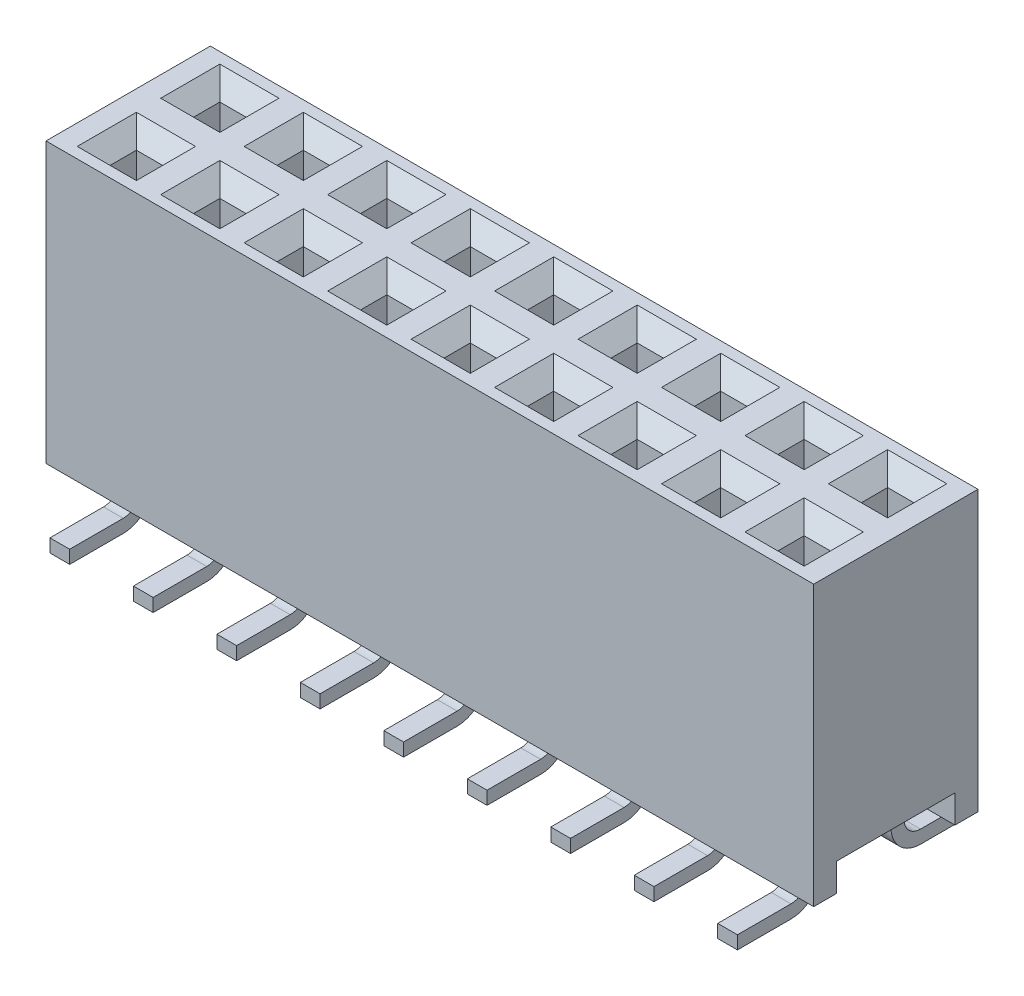
from build123d import *

# Parameters (mm, degrees)
EXTRUDE_1_DEPTH                    = 11.68
SKETCH_2_W                         = 0.8
SKETCH_2_H                         = 0.8
CUT_EXTRUDE_1_DEPTH                = 15.660231922
CHAMFER_1_SIZE                     = 0.5
PATTERN_LINEAR_1_COUNT             = 9
PATTERN_LINEAR_1_PITCH             = 2.54
PATTERN_LINEAR_1_COUNT_DIR2        = 2
PATTERN_LINEAR_1_PITCH_DIR2        = 2.54
CHAMFER_1_OF_PATTERN_LINEAR_1_SIZE = 0.5
EXTRUDE_2_DEPTH                    = 0.3
PATTERN_LINEAR_2_COUNT             = 5
PATTERN_LINEAR_2_PITCH             = 2.54
PATTERN_LINEAR_3_COUNT             = 5
PATTERN_LINEAR_3_PITCH             = 2.54


with BuildPart() as part:
    # Эскиз1 → Бобышка-Вытянуть1 (new, symmetric)
    with BuildSketch(Plane(origin=(0, 0, 0), x_dir=(0, 0, -1), z_dir=(1, 0, 0))):
        Polygon((-2.5, 1.2), (-2.5, 9.7), (2.5, 9.7), (2.5, 1.2), (1.8, 1.2), (1.8, 2.05), (-1.8, 2.05), (-1.8, 1.2), align=None)
    extrude(amount=EXTRUDE_1_DEPTH, both=True)

    # Эскиз2 → Вырез-Вытянуть1 (cut, through all)
    with BuildSketch(Plane(origin=(0, 9.7, 0), x_dir=(1, 0, 0), z_dir=(0, 1, 0))):
        with Locations((10.16, -1.27)):
            Rectangle(SKETCH_2_W, SKETCH_2_H)
    cut_extrude_1 = extrude(amount=-CUT_EXTRUDE_1_DEPTH, mode=Mode.SUBTRACT)

    # Фаска1
    chamfer_1_edges = [part.edges().sort_by_distance(p)[0] for p in [
        (10.56, 9.7, 1.27),
        (10.16, 9.7, 0.87),
        (9.76, 9.7, 1.27),
        (10.16, 9.7, 1.67),
    ]]
    chamfer(chamfer_1_edges, length=CHAMFER_1_SIZE)

    # Линейный массив1: Cut-Extrude 1 9 × 2
    with Locations(*[(-i * PATTERN_LINEAR_1_PITCH, 0, -j * PATTERN_LINEAR_1_PITCH_DIR2) for i in range(PATTERN_LINEAR_1_COUNT) for j in range(PATTERN_LINEAR_1_COUNT_DIR2) if (i, j) != (0, 0)]):
        add(cut_extrude_1, mode=Mode.SUBTRACT)

    # Фаска1 of Линейный массив1
    chamfer_1_of_pattern_linear_1_edges = [part.edges().sort_by_distance(p)[0] for p in [
        (10.56, 9.7, -1.27),
        (10.16, 9.7, -1.67),
        (9.76, 9.7, -1.27),
        (10.16, 9.7, -0.87),
        (8.02, 9.7, 1.27),
        (7.62, 9.7, 0.87),
        (7.22, 9.7, 1.27),
        (7.62, 9.7, 1.67),
        (8.02, 9.7, -1.27),
        (7.62, 9.7, -1.67),
        (7.22, 9.7, -1.27),
        (7.62, 9.7, -0.87),
        (5.48, 9.7, 1.27),
        (5.08, 9.7, 0.87),
        (4.68, 9.7, 1.27),
        (5.08, 9.7, 1.67),
        (5.48, 9.7, -1.27),
        (5.08, 9.7, -1.67),
        (4.68, 9.7, -1.27),
        (5.08, 9.7, -0.87),
        (2.94, 9.7, 1.27),
        (2.54, 9.7, 0.87),
        (2.14, 9.7, 1.27),
        (2.54, 9.7, 1.67),
        (2.94, 9.7, -1.27),
        (2.54, 9.7, -1.67),
        (2.14, 9.7, -1.27),
        (2.54, 9.7, -0.87),
        (0.4, 9.7, 1.27),
        (0, 9.7, 0.87),
        (-0.4, 9.7, 1.27),
        (0, 9.7, 1.67),
        (0.4, 9.7, -1.27),
        (0, 9.7, -1.67),
        (-0.4, 9.7, -1.27),
        (0, 9.7, -0.87),
        (-2.14, 9.7, 1.27),
        (-2.54, 9.7, 0.87),
        (-2.94, 9.7, 1.27),
        (-2.54, 9.7, 1.67),
        (-2.14, 9.7, -1.27),
        (-2.54, 9.7, -1.67),
        (-2.94, 9.7, -1.27),
        (-2.54, 9.7, -0.87),
        (-4.68, 9.7, 1.27),
        (-5.08, 9.7, 0.87),
        (-5.48, 9.7, 1.27),
        (-5.08, 9.7, 1.67),
        (-4.68, 9.7, -1.27),
        (-5.08, 9.7, -1.67),
        (-5.48, 9.7, -1.27),
        (-5.08, 9.7, -0.87),
        (-7.22, 9.7, 1.27),
        (-7.62, 9.7, 0.87),
        (-8.02, 9.7, 1.27),
        (-7.62, 9.7, 1.67),
        (-7.22, 9.7, -1.27),
        (-7.62, 9.7, -1.67),
        (-8.02, 9.7, -1.27),
        (-7.62, 9.7, -0.87),
        (-9.76, 9.7, 1.27),
        (-10.16, 9.7, 0.87),
        (-10.56, 9.7, 1.27),
        (-10.16, 9.7, 1.67),
        (-9.76, 9.7, -1.27),
        (-10.16, 9.7, -1.67),
        (-10.56, 9.7, -1.27),
        (-10.16, 9.7, -0.87),
    ]]
    chamfer(chamfer_1_of_pattern_linear_1_edges, length=CHAMFER_1_OF_PATTERN_LINEAR_1_SIZE)


with BuildPart() as body_2:
    # Эскиз3 → Бобышка-Вытянуть2 (new, symmetric)
    with BuildSketch(Plane(origin=(0, 0, 0), x_dir=(0, 0, -1), z_dir=(1, 0, 0))):
        with BuildLine():
            Line((-1.07, 0.9), (-1.07, 2.05))
            Line((-1.07, 2.05), (-1.47, 2.05))
            Line((-1.47, 2.05), (-1.47, 0.9))
            ThreePointArc((-1.47, 0.9), (-1.616446609, 0.546446609), (-1.97, 0.4))
            Line((-1.97, 0.4), (-3.6, 0.4))
            Line((-3.6, 0.4), (-3.6, 0))
            Line((-3.6, 0), (-1.97, 0))
            ThreePointArc((-1.97, 0), (-1.333603897, 0.263603897), (-1.07, 0.9))
        make_face()
    extrude(amount=EXTRUDE_2_DEPTH, both=True)


with BuildPart() as pattern_linear_2_1:
    # Линейный массив2: pattern copy
    add(body_2.part.moved(Location(Vector(1, 0, 0) * (1 * PATTERN_LINEAR_2_PITCH))))


with BuildPart() as pattern_linear_2_2:
    # Линейный массив2: pattern copy
    add(body_2.part.moved(Location(Vector(1, 0, 0) * (2 * PATTERN_LINEAR_2_PITCH))))


with BuildPart() as pattern_linear_2_3:
    # Линейный массив2: pattern copy
    add(body_2.part.moved(Location(Vector(1, 0, 0) * (3 * PATTERN_LINEAR_2_PITCH))))


with BuildPart() as pattern_linear_2_4:
    # Линейный массив2: pattern copy
    add(body_2.part.moved(Location(Vector(1, 0, 0) * (4 * PATTERN_LINEAR_2_PITCH))))


with BuildPart() as pattern_linear_3_1:
    # Линейный массив3: pattern copy
    add(body_2.part.moved(Location(Vector(-1, 0, 0) * (1 * PATTERN_LINEAR_3_PITCH))))


with BuildPart() as pattern_linear_3_2:
    # Линейный массив3: pattern copy
    add(body_2.part.moved(Location(Vector(-1, 0, 0) * (2 * PATTERN_LINEAR_3_PITCH))))


with BuildPart() as pattern_linear_3_3:
    # Линейный массив3: pattern copy
    add(body_2.part.moved(Location(Vector(-1, 0, 0) * (3 * PATTERN_LINEAR_3_PITCH))))


with BuildPart() as pattern_linear_3_4:
    # Линейный массив3: pattern copy
    add(body_2.part.moved(Location(Vector(-1, 0, 0) * (4 * PATTERN_LINEAR_3_PITCH))))


with BuildPart() as body_11:
    # Зеркальное отражение1: mirrored copy
    add(pattern_linear_3_4.part.mirror(Plane.XY))


with BuildPart() as body_12:
    # Mirror 1 2: mirrored copy
    add(pattern_linear_3_3.part.mirror(Plane.XY))


with BuildPart() as body_13:
    # Mirror 1 3: mirrored copy
    add(pattern_linear_3_2.part.mirror(Plane.XY))


with BuildPart() as body_14:
    # Mirror 1 4: mirrored copy
    add(pattern_linear_3_1.part.mirror(Plane.XY))


with BuildPart() as body_15:
    # Mirror 1 5: mirrored copy
    add(body_2.part.mirror(Plane.XY))


with BuildPart() as body_16:
    # Mirror 1 6: mirrored copy
    add(pattern_linear_2_1.part.mirror(Plane.XY))


with BuildPart() as body_17:
    # Mirror 1 7: mirrored copy
    add(pattern_linear_2_2.part.mirror(Plane.XY))


with BuildPart() as body_18:
    # Mirror 1 8: mirrored copy
    add(pattern_linear_2_3.part.mirror(Plane.XY))


with BuildPart() as body_19:
    # Mirror 1 9: mirrored copy
    add(pattern_linear_2_4.part.mirror(Plane.XY))


solid = Compound([part.part, body_2.part, pattern_linear_2_1.part, pattern_linear_2_2.part, pattern_linear_2_3.part, pattern_linear_2_4.part, pattern_linear_3_1.part, pattern_linear_3_2.part, pattern_linear_3_3.part, pattern_linear_3_4.part, body_11.part, body_12.part, body_13.part, body_14.part, body_15.part, body_16.part, body_17.part, body_18.part, body_19.part])
